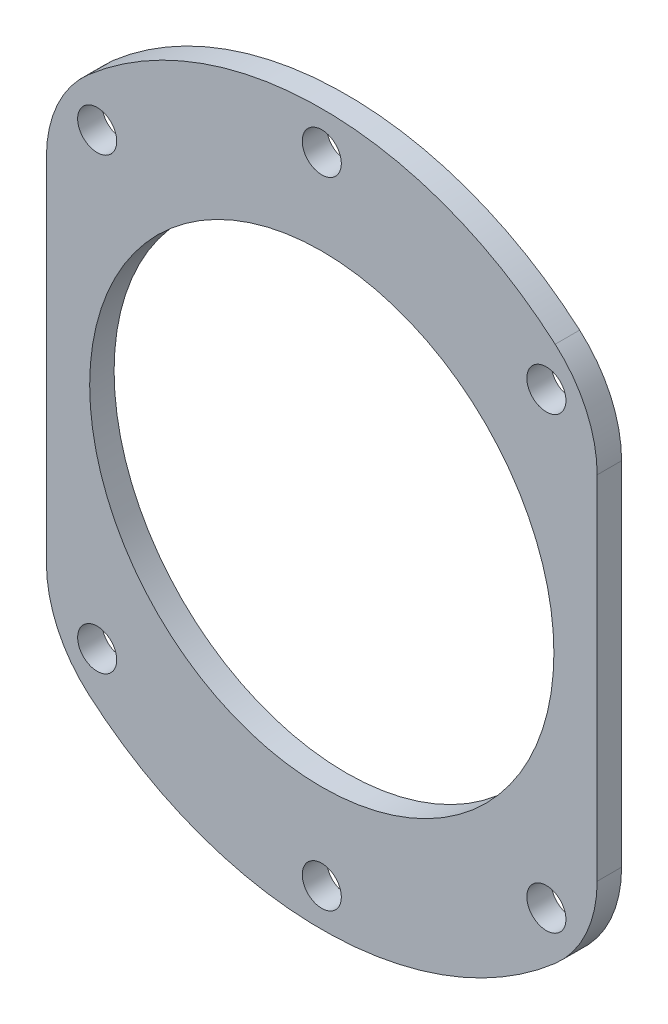
from build123d import *

# Parameters (mm, degrees)
SKETCH1_R           = 19
BOSS_EXTRUDE1_DEPTH = 2
SKETCH2_R           = 1.6
CUT_EXTRUDE1_DEPTH  = 87.413117357
FILLET1_R           = 10


with BuildPart() as part:
    # Sketch1 → Boss-Extrude1 (new body)
    with BuildSketch(Plane.XY):
        with BuildLine():
            Line((-81.341360029, 18.403724841), (-81.341360029, -18.403724841))
            ThreePointArc((-81.341360029, -18.403724841), (-58.8, -29.1), (-36.258639971, -18.403724841))
            Line((-36.258639971, -18.403724841), (-36.258639971, 18.403724841))
            ThreePointArc((-36.258639971, 18.403724841), (-58.8, 29.1), (-81.341360029, 18.403724841))
        make_face()
        with Locations((-58.8, 0)):
            Circle(SKETCH1_R, mode=Mode.SUBTRACT)
    extrude(amount=BOSS_EXTRUDE1_DEPTH)

    # Sketch2 → Cut-Extrude1 (cut, through all)
    with BuildSketch(Plane.XY.offset(2)):
        with Locations((-58.8, 26)):
            Circle(SKETCH2_R)
        with Locations((-40.415223689, 18.384776311)):
            Circle(SKETCH2_R)
        with Locations((-40.415223689, -18.384776311)):
            Circle(SKETCH2_R)
        with Locations((-58.8, -26)):
            Circle(SKETCH2_R)
        with Locations((-77.184776311, -18.384776311)):
            Circle(SKETCH2_R)
        with Locations((-77.184776311, 18.384776311)):
            Circle(SKETCH2_R)
    extrude(amount=-CUT_EXTRUDE1_DEPTH, mode=Mode.SUBTRACT)

    # Fillet1
    fillet1_edges = [part.edges().sort_by_distance(p)[0] for p in [
        (-81.341360029, -18.403724841, 1),
        (-81.341360029, 18.403724841, 1),
        (-36.258639971, 18.403724841, 1),
        (-36.258639971, -18.403724841, 1),
    ]]
    fillet(fillet1_edges, radius=FILLET1_R)


solid = part.part
